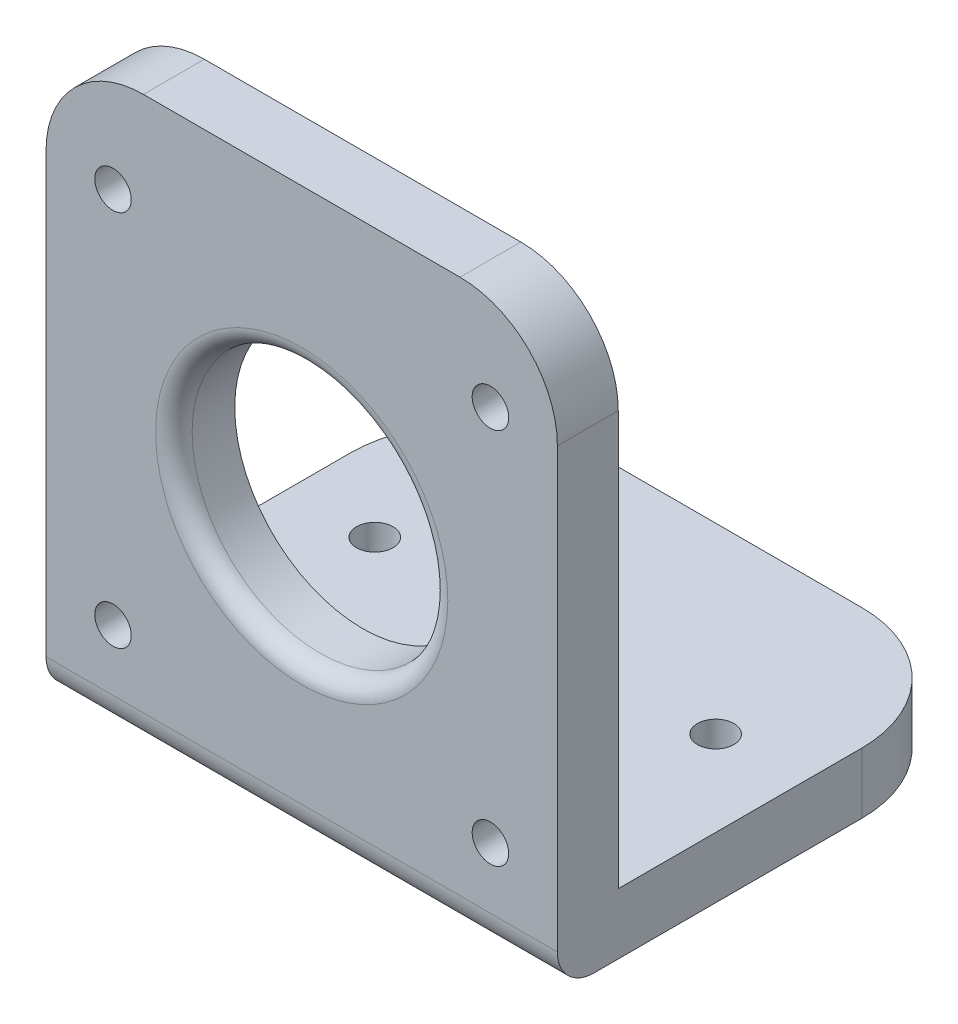
from build123d import *

# Parameters (mm, degrees)
ESQUISSE1_R             = 10.5
BOSS_EXTRU_1_DEPTH      = 5
ESQUISSE2_W             = 42
ESQUISSE2_H             = 5
BOSS_EXTRU_2_DEPTH      = 30
ESQUISSE3_R             = 1.5
ENL_V_MAT_EXTRU_1_DEPTH = 30
CONG_1_R                = 10
CONG_2_R                = 3
ESQUISSE4_R             = 1.5
ESQUISSE4_R_2           = 1.499999579
ENL_V_MAT_EXTRU_2_DEPTH = 44.511492735
CONG_3_R                = 1.5


with BuildPart() as part:
    # Esquisse1 → Boss.-Extru.1 (new body)
    with BuildSketch(Plane.XY):
        with BuildLine():
            Line((-13, 23.5), (13, 23.5))
            ThreePointArc((13, 23.5), (18.656854249, 21.156854249), (21, 15.5))
            Line((21, 15.5), (21, -23.5))
            Line((21, -23.5), (-21, -23.5))
            Line((-21, -23.5), (-21, 15.5))
            ThreePointArc((-21, 15.5), (-18.656854249, 21.156854249), (-13, 23.5))
        make_face()
        Circle(ESQUISSE1_R, mode=Mode.SUBTRACT)
    extrude(amount=BOSS_EXTRU_1_DEPTH)

    # Esquisse2 → Boss.-Extru.2 (add)
    with BuildSketch(Plane(origin=(0, 0, 0), x_dir=(-1, 0, 0), z_dir=(0, 0, -1))):
        with Locations((0, -21)):
            Rectangle(ESQUISSE2_W, ESQUISSE2_H)
    extrude(amount=BOSS_EXTRU_2_DEPTH)

    # Esquisse3 → Enlèv. mat.-Extru.1 (cut)
    with BuildSketch(Plane(origin=(0, -18.5, 0), x_dir=(1, 0, 0), z_dir=(0, 1, 0))):
        with Locations(Location((-14, 15, 0), (0, 0, 270))):
            Circle(ESQUISSE3_R)
        with Locations(Location((14, 15, 0), (0, 0, 270))):
            Circle(ESQUISSE3_R)
    extrude(amount=-ENL_V_MAT_EXTRU_1_DEPTH, mode=Mode.SUBTRACT)

    # Congé1
    cong_1_edges = [part.edges().sort_by_distance(p)[0] for p in [
        (-21, -21, -30),
        (21, -21, -30),
    ]]
    fillet(cong_1_edges, radius=CONG_1_R)

    # Congé2
    cong_2_edges = [part.edges().sort_by_distance(p)[0] for p in [
        (0, -23.5, 5),
    ]]
    fillet(cong_2_edges, radius=CONG_2_R)

    # Esquisse4 → Enlèv. mat.-Extru.2 (cut, through all)
    with BuildSketch(Plane(origin=(0, 0, 0), x_dir=(-1, 0, 0), z_dir=(0, 0, -1))):
        with Locations((-15.5, 15.5)):
            Circle(ESQUISSE4_R)
        with Locations((15.5, 15.5)):
            Circle(ESQUISSE4_R)
        with Locations((-15.499999687, -15.500000313)):
            Circle(ESQUISSE4_R_2)
        with Locations((15.5, -15.5)):
            Circle(ESQUISSE4_R)
    extrude(amount=-ENL_V_MAT_EXTRU_2_DEPTH, mode=Mode.SUBTRACT)

    # Congé3
    cong_3_edges = [part.edges().sort_by_distance(p)[0] for p in [
        (-10.5, 0, 5),
    ]]
    fillet(cong_3_edges, radius=CONG_3_R)


solid = part.part
